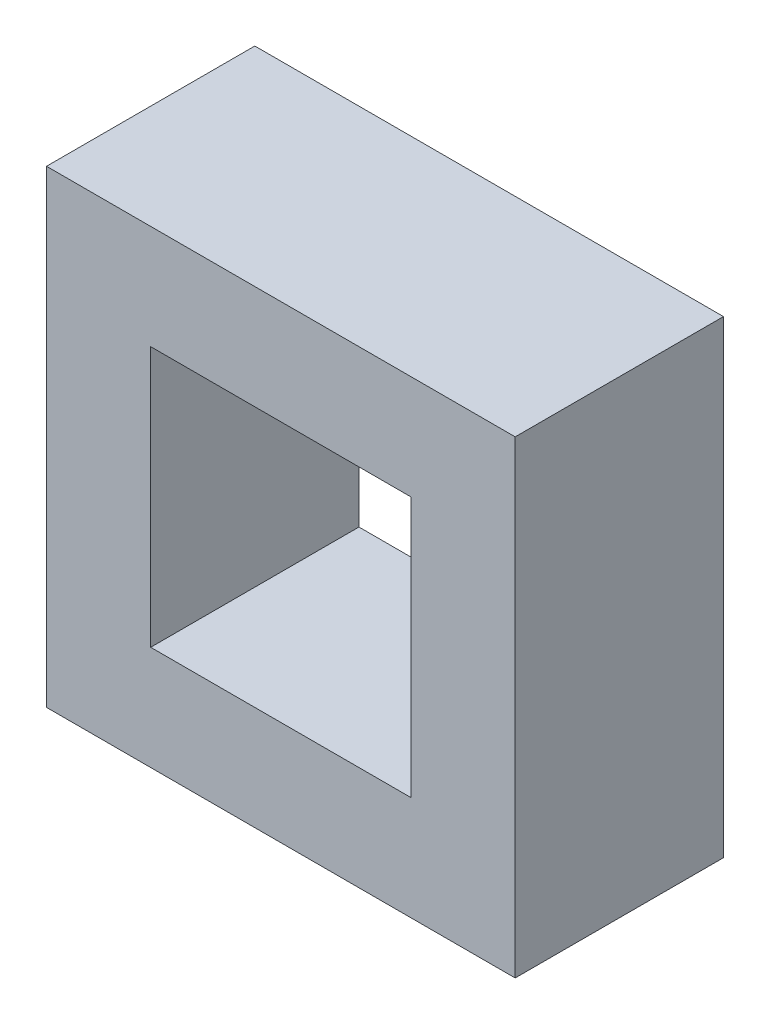
from build123d import *

# Parameters (mm, degrees)
SKETCH1_W           = 45
SKETCH1_H           = 45
SKETCH1_W_2         = 25
SKETCH1_H_2         = 25
BOSS_EXTRUDE1_DEPTH = 20


with BuildPart() as part:
    # Sketch1 → Boss-Extrude1 (new body)
    with BuildSketch(Plane.XY):
        Rectangle(SKETCH1_W, SKETCH1_H)
        Rectangle(SKETCH1_W_2, SKETCH1_H_2, mode=Mode.SUBTRACT)
    extrude(amount=BOSS_EXTRUDE1_DEPTH)


solid = part.part
